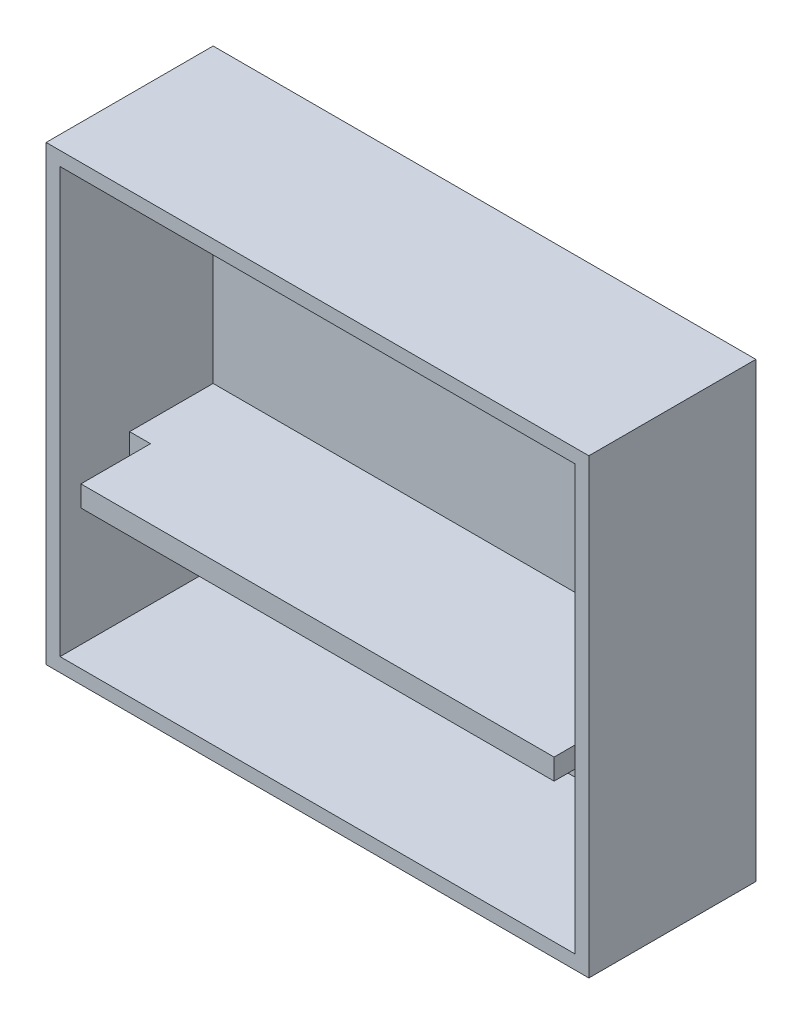
from build123d import *

# Parameters (mm, degrees)
SKETCH1_W           = 78
SKETCH1_H           = 65
BOSS_EXTRUDE1_DEPTH = 24
SKETCH2_W           = 74
SKETCH2_H           = 61
CUT_EXTRUDE1_DEPTH  = 22
SKETCH3_W           = 74
SKETCH3_H           = 3
BOSS_EXTRUDE2_DEPTH = 22
SKETCH4_W           = 3
SKETCH4_H           = 3
CUT_EXTRUDE2_DEPTH  = 10
SKETCH5_R           = 2.5
BOSS_EXTRUDE3_DEPTH = 3
SKETCH6_R           = 1
BOSS_EXTRUDE4_DEPTH = 5


with BuildPart() as part:
    # Sketch1 → Boss-Extrude1 (new body)
    with BuildSketch(Plane.XY):
        with Locations((39, 32.5)):
            Rectangle(SKETCH1_W, SKETCH1_H)
    extrude(amount=BOSS_EXTRUDE1_DEPTH)

    # Sketch2 → Cut-Extrude1 (cut)
    with BuildSketch(Plane.XY.offset(24)):
        with Locations((39, 32.5)):
            Rectangle(SKETCH2_W, SKETCH2_H)
    extrude(amount=-CUT_EXTRUDE1_DEPTH, mode=Mode.SUBTRACT)

    # Sketch3 → Boss-Extrude2 (add)
    with BuildSketch(Plane.XY.offset(2)):
        with Locations((39, 23.5)):
            Rectangle(SKETCH3_W, SKETCH3_H)
    extrude(amount=BOSS_EXTRUDE2_DEPTH)

    # Sketch4 → Cut-Extrude2 (cut)
    with BuildSketch(Plane.XY.offset(24)):
        with Locations((3.5, 23.5)):
            Rectangle(SKETCH4_W, SKETCH4_H)
        with Locations((74.5, 23.5)):
            Rectangle(SKETCH4_W, SKETCH4_H)
    extrude(amount=-CUT_EXTRUDE2_DEPTH, mode=Mode.SUBTRACT)

    # Sketch5 → Boss-Extrude3 (add)
    with BuildSketch(Plane.XY.offset(2)):
        with Locations((20.5, 56)):
            Circle(SKETCH5_R)
        with Locations((69, 56)):
            Circle(SKETCH5_R)
    extrude(amount=BOSS_EXTRUDE3_DEPTH)

    # Sketch6 → Boss-Extrude4 (add)
    with BuildSketch(Plane.XY.offset(5)):
        with Locations((20.5, 56)):
            Circle(SKETCH6_R)
        with Locations((69, 56)):
            Circle(SKETCH6_R)
    extrude(amount=BOSS_EXTRUDE4_DEPTH)


solid = part.part
